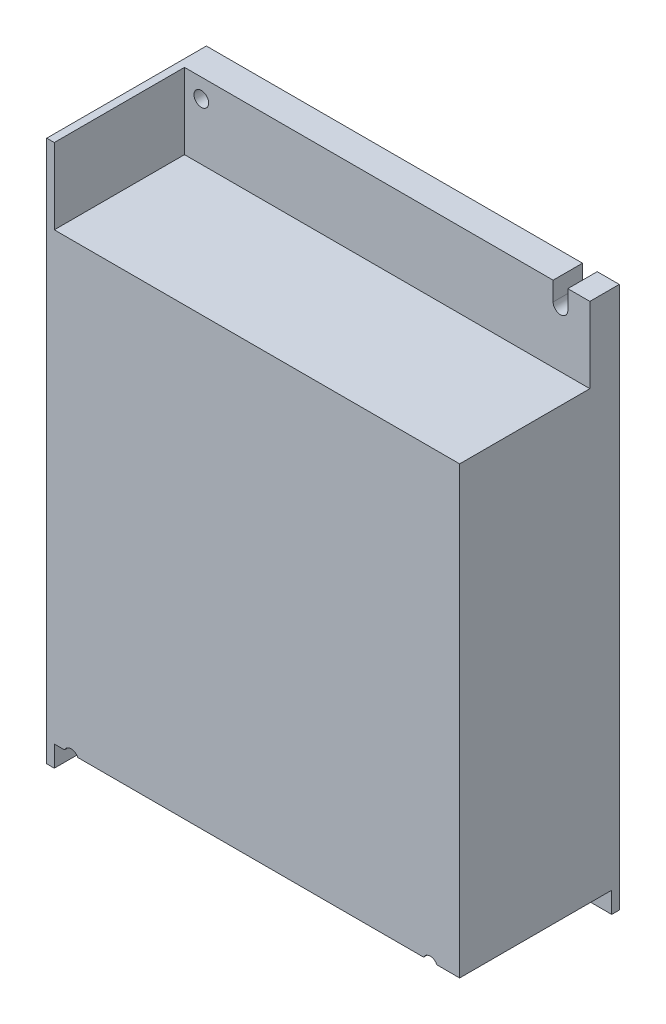
from build123d import *

# Parameters (mm, degrees)
SKETCH_1_W          = 98.3
SKETCH_1_H          = 129
EXTRUDE_1_DEPTH     = 38
SKETCH_2_W          = 96.5
SKETCH_2_H          = 18
CUT_EXTRUDE_1_DEPTH = 31
SKETCH_3_W          = 96.5
SKETCH_3_H          = 5
CUT_EXTRUDE_2_DEPTH = 36.2
SKETCH_4_R          = 1.75
CUT_EXTRUDE_3_DEPTH = 90.554299171


with BuildPart() as part:
    # 草图1 → 凸台-拉伸1 (new body)
    with BuildSketch(Plane.XY):
        Rectangle(SKETCH_1_W, SKETCH_1_H)
    extrude(amount=EXTRUDE_1_DEPTH)

    # 草图2 → 切除-拉伸1 (cut)
    with BuildSketch(Plane.XY.offset(38)):
        with Locations((0.9, 55.5)):
            Rectangle(SKETCH_2_W, SKETCH_2_H)
    extrude(amount=-CUT_EXTRUDE_1_DEPTH, mode=Mode.SUBTRACT)

    # 草图3 → 切除-拉伸2 (cut)
    with BuildSketch(Plane.XY.offset(38)):
        with Locations((0.9, -62)):
            Rectangle(SKETCH_3_W, SKETCH_3_H)
    extrude(amount=-CUT_EXTRUDE_2_DEPTH, mode=Mode.SUBTRACT)

    # 草图4 → 切除-拉伸3 (cut, through all)
    with BuildSketch(Plane(origin=(0, 0, 0), x_dir=(-1, 0, 0), z_dir=(0, 0, -1))):
        with Locations((43.35, 60)):
            Circle(SKETCH_4_R)
        with BuildLine():
            Line((-40.4, 60), (-40.4, 64.5))
            Line((-40.4, 64.5), (-43.9, 64.5))
            Line((-43.9, 64.5), (-43.9, 60))
            ThreePointArc((-43.9, 60), (-42.15, 58.25), (-40.4, 60))
        make_face()
        with BuildLine():
            Line((-40.4, -60.25), (-40.4, -64.5))
            Line((-40.4, -64.5), (-43.9, -64.5))
            Line((-43.9, -64.5), (-43.9, -60.25))
            ThreePointArc((-43.9, -60.25), (-42.15, -58.5), (-40.4, -60.25))
        make_face()
        with BuildLine():
            Line((41.6, -61.5), (41.6, -60.25))
            ThreePointArc((41.6, -60.25), (43.35, -58.5), (45.1, -60.25))
            Line((45.1, -60.25), (45.1, -61.5))
            ThreePointArc((45.1, -61.5), (43.35, -63.25), (41.6, -61.5))
        make_face()
    extrude(amount=-CUT_EXTRUDE_3_DEPTH, mode=Mode.SUBTRACT)


solid = part.part
